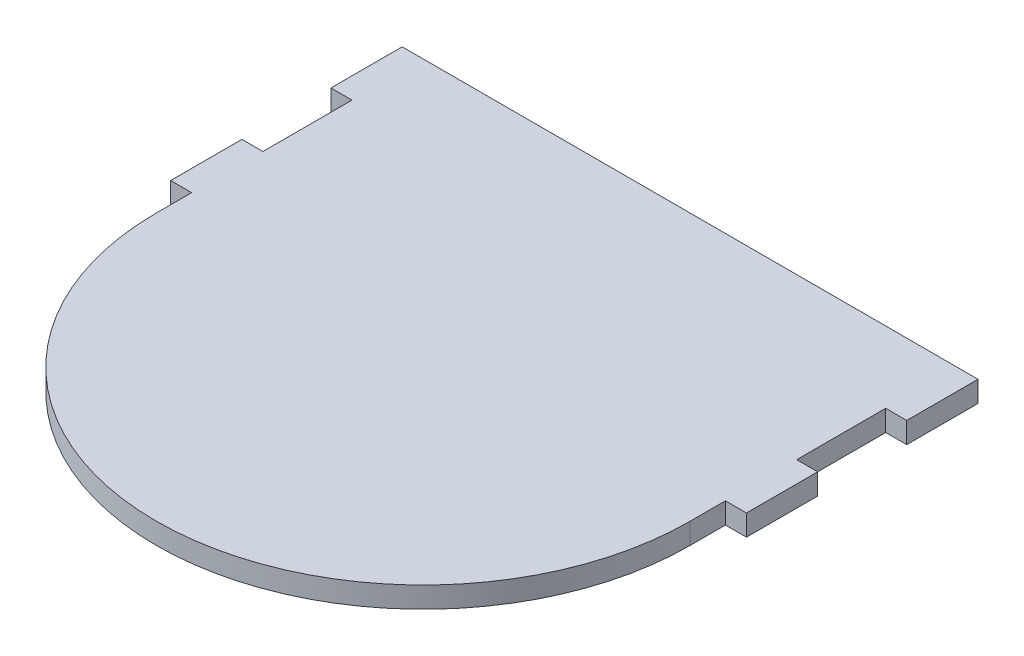
from build123d import *

# Parameters (mm, degrees)
BOSS_EXTRUDE1_DEPTH = 4.999999906
SKETCH3_W           = 4.999999906
SKETCH3_H           = 16.959219297
BOSS_EXTRUDE2_DEPTH = 4.999999906


with BuildPart() as part:
    # Sketch2 → Boss-Extrude1 (new body)
    with BuildSketch(Plane.XZ):
        with BuildLine():
            Line((-63.5, 63.5), (-63.5, 0))
            Line((-63.5, 0), (63.5, 0))
            Line((63.5, 0), (63.5, 63.5))
            ThreePointArc((63.5, 63.5), (0, 127), (-63.5, 63.5))
        make_face()
    extrude(amount=BOSS_EXTRUDE1_DEPTH)

    # Sketch3 → Boss-Extrude2 (add)
    with BuildSketch(Plane.XZ.offset(4.999999906)):
        with Locations((65.999999953, 8.479609649)):
            Rectangle(SKETCH3_W, SKETCH3_H)
        with Locations((65.999999953, 46.614250443)):
            Rectangle(SKETCH3_W, SKETCH3_H)
        with Locations((-65.999999953, 46.614250443)):
            Rectangle(SKETCH3_W, SKETCH3_H)
        with Locations((-65.999999953, 8.479609649)):
            Rectangle(SKETCH3_W, SKETCH3_H)
    extrude(amount=-BOSS_EXTRUDE2_DEPTH)


solid = part.part
